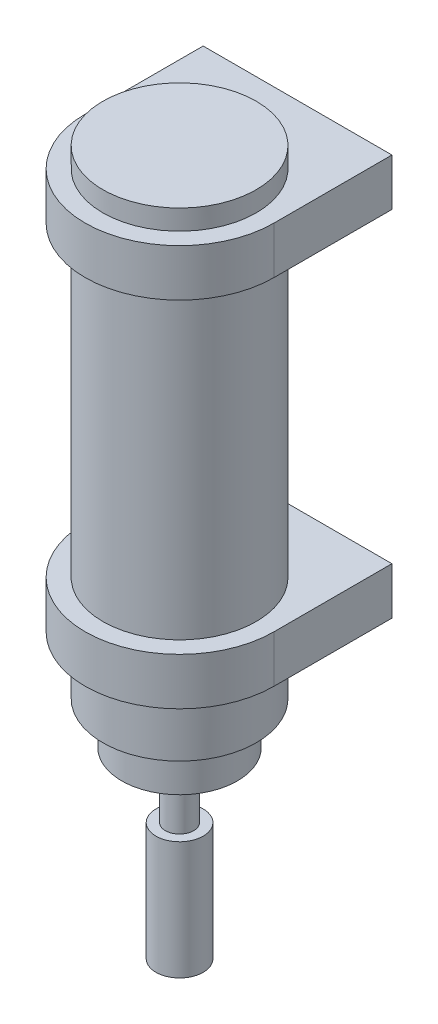
from build123d import *

# Parameters (mm, degrees)
BOSS_EXTRUDE1_START = 70
SKETCH2_R           = 32.5
BOSS_EXTRUDE1_DEPTH = 20
LPATTERN1_COUNT     = 2
LPATTERN1_PITCH     = 150
SKETCH4_R           = 10
BOSS_EXTRUDE2_DEPTH = 50


with BuildPart() as part:
    # Sketch1 → Revolve1 (revolve)
    with BuildSketch(Plane.XY, mode=Mode.PRIVATE) as revolve1_sk:
        Polygon((0, 248.5), (-32.5, 248.5), (-32.5, 45.5), (-24.5, 45.5), (-24.5, 27.5), (-6, 27.5), (-6, 0), (0, 0), align=None)
    revolve(revolve1_sk.sketch.rotate(Axis((0, 0, 0), (0, 1, 0)), 270), axis=Axis((0, 0, 0), (0, 1, 0)))

    # Sketch2 → Boss-Extrude1 (add)
    with BuildSketch(Plane(origin=(0, 0, 0), x_dir=(1, 0, 0), z_dir=(0, 1, 0)).offset(BOSS_EXTRUDE1_START)):
        with BuildLine():
            Line((-40, 0), (-40, 50))
            Line((-40, 50), (40, 50))
            Line((40, 50), (40, 0))
            ThreePointArc((40, 0), (0, -40), (-40, 0))
        make_face()
        with Locations(Location((0, 0, 0), (0, 0, 90))):
            Circle(SKETCH2_R, mode=Mode.SUBTRACT)
    boss_extrude1 = extrude(amount=BOSS_EXTRUDE1_DEPTH)

    # LPattern1: Boss-Extrude1 ×2
    with Locations(*[(0, i * LPATTERN1_PITCH, 0) for i in range(1, LPATTERN1_COUNT)]):
        add(boss_extrude1)

    # Sketch4 → Boss-Extrude2 (add)
    with BuildSketch(Plane.XZ):
        Circle(SKETCH4_R)
    extrude(amount=BOSS_EXTRUDE2_DEPTH)


solid = part.part
